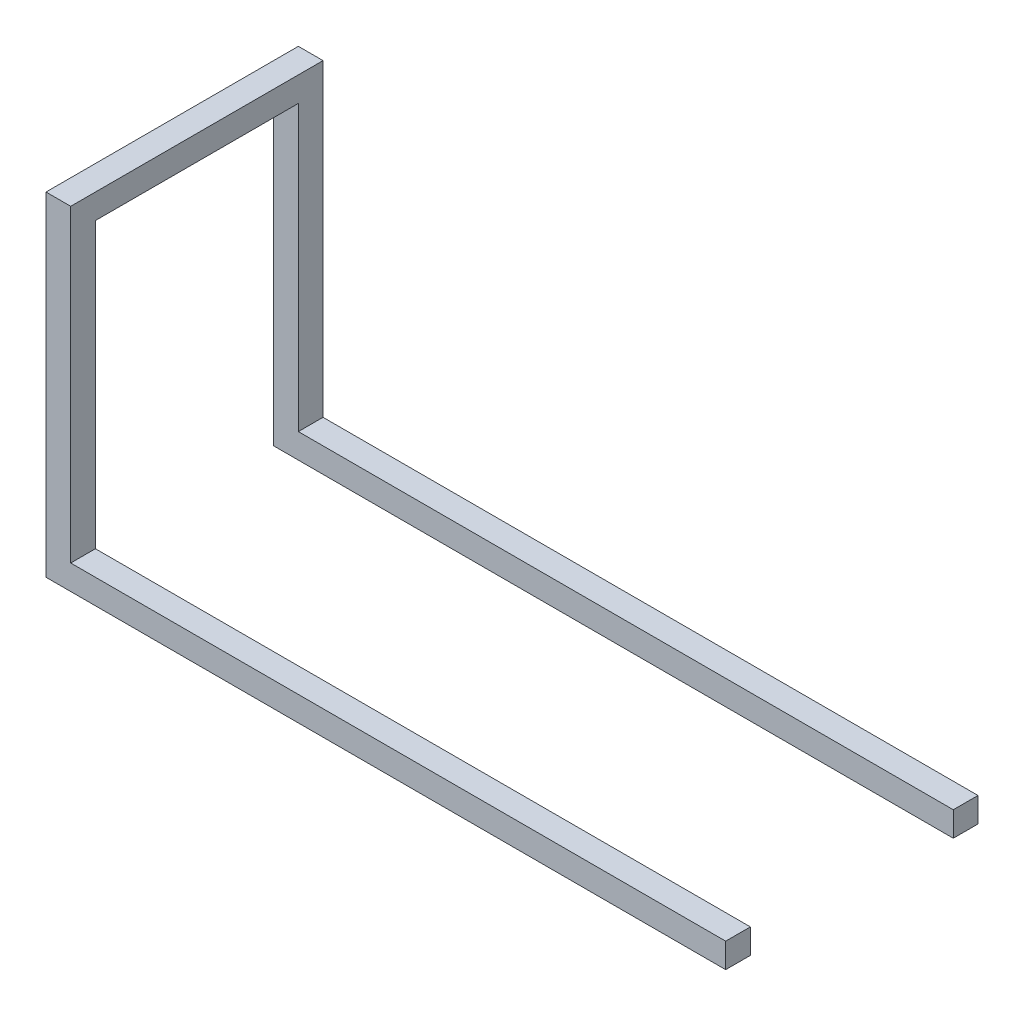
from build123d import *

# Parameters (mm, degrees)
EXTRUDE_1_DEPTH = 40
SKETCH_6_W      = 40
SKETCH_6_H      = 408.4
EXTRUDE_2_DEPTH = 40


with BuildPart() as part:
    # 草图2 → 凸台-拉伸1 (new body)
    with BuildSketch(Plane.XY.offset(164.2)):
        Polygon((-475, 0), (585, 0), (585, -40), (-515, -40), (-515, 500), (-475, 500), (-475, 460), align=None)
    extrude(amount=EXTRUDE_1_DEPTH)


with BuildPart() as body_2:
    # 镜向4: mirrored copy
    add(part.part.mirror(Plane.XY))


with BuildPart() as part_1:
    add(part.part)

    add(body_2.part)  # 凸台-拉伸2 merges body 2
    # 草图6 → 凸台-拉伸2 (add)
    with BuildSketch(Plane(origin=(0, 500, 0), x_dir=(1, 0, 0), z_dir=(0, 1, 0))):
        with Locations((-495, 0)):
            Rectangle(SKETCH_6_W, SKETCH_6_H)
    extrude(amount=-EXTRUDE_2_DEPTH)


solid = part_1.part
